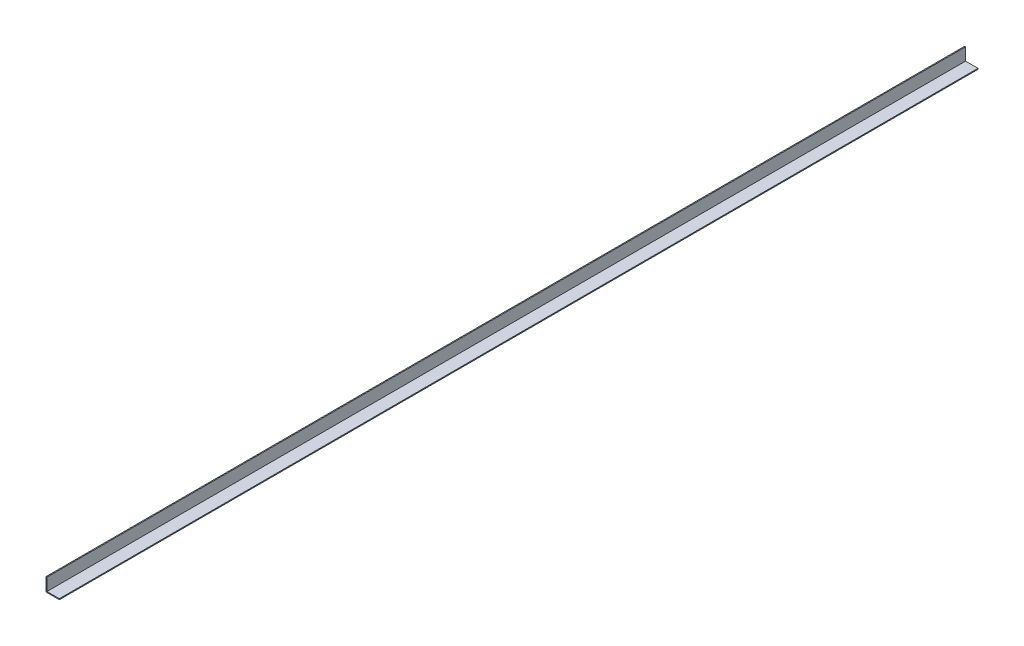
from build123d import *

# Parameters (mm, degrees)
SALIENTE_EXTRUIR1_DEPTH = 6100


with BuildPart() as part:
    # Croquis1 → Saliente-Extruir1 (new body)
    with BuildSketch(Plane.XY):
        Polygon((0, 88.9), (0, 0), (88.9, 0), (88.9, 6.35), (6.35, 6.35), (6.35, 88.9), align=None)
    extrude(amount=-SALIENTE_EXTRUIR1_DEPTH)


solid = part.part
